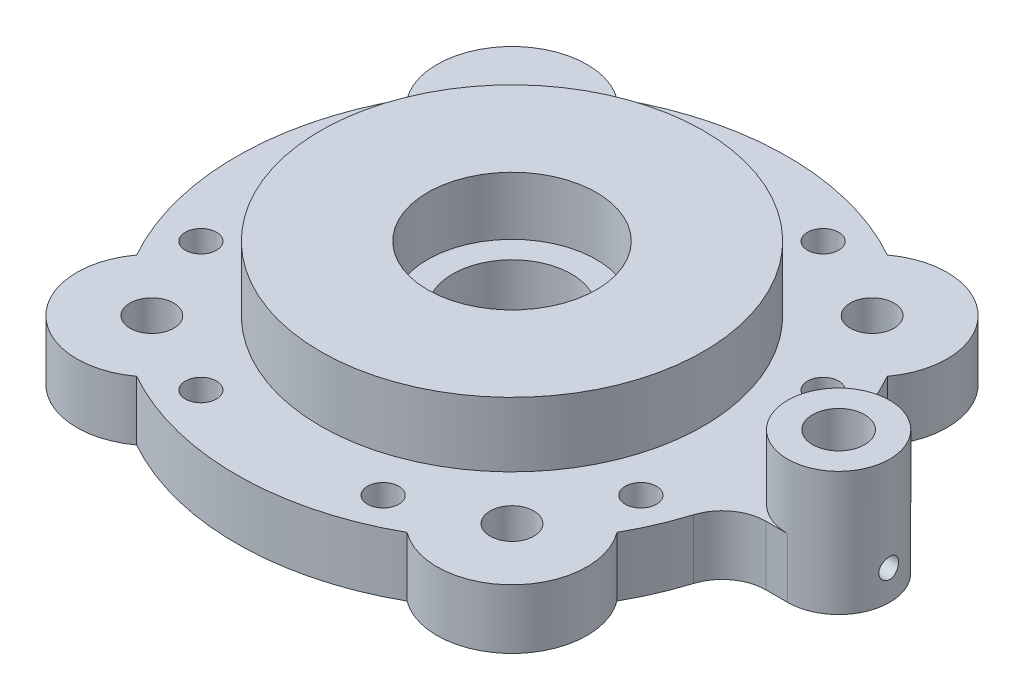
from build123d import *

# Parameters (mm, degrees)
BASE_DEPTH                       = 9.525
SQUARE_BOLT_HOLES_DEPTH          = 76.417831
SQUARE_BOLT_HOLES_DEPTH_BACK     = 76.417831
SKETCH3_R                        = 3.5
SKETCH11_R                       = 12
SKETCH11_R_2                     = 3.5
BOSS_EXTRUDE1_DEPTH              = 9.525
SKETCH4_R                        = 2.5
HOUSING_BOLTS_DEPTH              = 44.33
CIRPATTERN1_COUNT                = 8
SKETCH2_R                        = 30.626685
SKETCH2_R_2                      = 8.167187
SKETCH2_R_3                      = 4.167187
IMPELLER_CAVITY_RISER_DEPTH      = 10.32955
SKETCH5_R                        = 13.5
SEAL_BORE_DEPTH                  = 9.3
SKETCH6_R                        = 9.5
BORE_DEPTH                       = 39.3
PRESSURE_TAP_DEPTH               = 101.589528
PRESSURE_TAP_DEPTH_BACK          = 52.75
SKETCH9_R                        = 1.5875
SKETCH10_R                       = 1.5875
PRESSURE_TAP_VERTICAL_HOLE_DEPTH = 6.35


with BuildPart() as part:
    # Sketch1 → base (new body)
    with BuildSketch(Plane(origin=(0, 0, 0), x_dir=(1, 0, 0), z_dir=(0, 1, 0))):
        with BuildLine():
            Line((48.797197, 8.167187), (52.267188, 8.167188))
            ThreePointArc((52.267188, 8.167188), (60.434375, 0), (52.267188, -8.167188))
            Line((52.267188, -8.167188), (48.797197, -8.167188))
            ThreePointArc((48.797197, -8.167188), (44.646527, -9.530527), (42.112649, -13.089491))
            ThreePointArc((42.112649, -13.089491), (-44.1, 0), (42.112649, 13.089491))
            ThreePointArc((42.112649, 13.089491), (44.646527, 9.530527), (48.797197, 8.167187))
        make_face()
    extrude(amount=BASE_DEPTH)

    # Sketch3 → square bolt holes (cut, two sides: drawn at the far end of the back side and taken through both)
    with BuildSketch(Plane.XZ.offset(-SQUARE_BOLT_HOLES_DEPTH_BACK)):
        with Locations((-28.814601, -28.814601)):
            Circle(SKETCH3_R)
        with Locations((-28.814601, 28.814601)):
            Circle(SKETCH3_R)
        with Locations((28.814601, 28.814601)):
            Circle(SKETCH3_R)
        with Locations((28.814601, -28.814601)):
            Circle(SKETCH3_R)
    extrude(amount=SQUARE_BOLT_HOLES_DEPTH + SQUARE_BOLT_HOLES_DEPTH_BACK, mode=Mode.SUBTRACT)

    # Sketch11 → Boss-Extrude1 (add)
    # profile 1 of 4: a face of its own
    with BuildSketch(Plane.XZ):
        with Locations((-28.814601, 28.814601)):
            Circle(SKETCH11_R)
        with Locations(Location((-28.814601, 28.814601, 0), (0, 0, 270))):
            Circle(SKETCH11_R_2, mode=Mode.SUBTRACT)
    # profile 2 of 4: a face of its own
    with BuildSketch(Plane.XZ):
        with Locations((28.814601, 28.814601)):
            Circle(SKETCH11_R)
        with Locations(Location((28.814601, 28.814601, 0), (0, 0, 270))):
            Circle(SKETCH11_R_2, mode=Mode.SUBTRACT)
    # profile 3 of 4: a face of its own
    with BuildSketch(Plane.XZ):
        with Locations((28.814601, -28.814601)):
            Circle(SKETCH11_R)
        with Locations(Location((28.814601, -28.814601, 0), (0, 0, 270))):
            Circle(SKETCH11_R_2, mode=Mode.SUBTRACT)
    # profile 4 of 4: a face of its own
    with BuildSketch(Plane.XZ):
        with Locations((-28.814601, -28.814601)):
            Circle(SKETCH11_R)
        with Locations(Location((-28.814601, -28.814601, 0), (0, 0, 270))):
            Circle(SKETCH11_R_2, mode=Mode.SUBTRACT)
    extrude(amount=-BOSS_EXTRUDE1_DEPTH)

    # Sketch4 → housing bolts (cut)
    with BuildSketch(Plane(origin=(0, 9.525, 0), x_dir=(1, 0, 0), z_dir=(0, 1, 0))):
        with Locations(Location((14.580239, 35.19981, 0), (0, 0, 270))):
            Circle(SKETCH4_R)
    housing_bolts = extrude(amount=-HOUSING_BOLTS_DEPTH, mode=Mode.SUBTRACT)

    # CirPattern1: housing bolts ×8 about axis
    cirpattern1_axis = Axis((0, 0, 0), (0, 1, 0))
    for i in range(1, CIRPATTERN1_COUNT):
        add(housing_bolts.rotate(cirpattern1_axis, i * 360 / CIRPATTERN1_COUNT), mode=Mode.SUBTRACT)

    # Sketch2 → impeller cavity riser (add)
    # profile 1 of 2: a face of its own
    with BuildSketch(Plane(origin=(0, 9.525, 0), x_dir=(1, 0, 0), z_dir=(0, 1, 0))):
        with Locations(Location((0, 0, 0), (0, 0, 270))):
            Circle(SKETCH2_R)
    # profile 2 of 2: a face of its own
    with BuildSketch(Plane(origin=(0, 9.525, 0), x_dir=(1, 0, 0), z_dir=(0, 1, 0))):
        with Locations(Location((52.267188, 0, 0), (0, 0, 270))):
            Circle(SKETCH2_R_2)
        with Locations(Location((52.267188, 0, 0), (0, 0, 270))):
            Circle(SKETCH2_R_3, mode=Mode.SUBTRACT)
    extrude(amount=IMPELLER_CAVITY_RISER_DEPTH)

    # Sketch5 → seal bore (cut)
    with BuildSketch(Plane(origin=(0, 19.85455, 0), x_dir=(1, 0, 0), z_dir=(0, 1, 0))):
        with Locations(Location((0, 0, 0), (0, 0, 270))):
            Circle(SKETCH5_R)
    extrude(amount=-SEAL_BORE_DEPTH, mode=Mode.SUBTRACT)

    # Sketch6 → bore (cut)
    with BuildSketch(Plane(origin=(0, 10.55455, 0), x_dir=(1, 0, 0), z_dir=(0, 1, 0))):
        with Locations(Location((0, 0, 0), (0, 0, 270))):
            Circle(SKETCH6_R)
    extrude(amount=-BORE_DEPTH, mode=Mode.SUBTRACT)

    # Sketch9 → pressure tap (cut, two sides: drawn at the far end of the back side and taken through both)
    with BuildSketch(Plane(origin=(44.1, 0, 0), x_dir=(0, 0, -1), z_dir=(1, 0, 0)).offset(-PRESSURE_TAP_DEPTH_BACK)):
        with Locations(Location((0, 4.7625, 0), (0, 0, 180))):
            Circle(SKETCH9_R)
    extrude(amount=PRESSURE_TAP_DEPTH + PRESSURE_TAP_DEPTH_BACK, mode=Mode.SUBTRACT)

    # Sketch10 → pressure tap vertical hole (cut)
    with BuildSketch(Plane(origin=(0, 9.525, 0), x_dir=(1, 0, 0), z_dir=(0, 1, 0))):
        with Locations(Location((52.267188, 0, 0), (0, 0, 270))):
            Circle(SKETCH10_R)
    extrude(amount=-PRESSURE_TAP_VERTICAL_HOLE_DEPTH, mode=Mode.SUBTRACT)


solid = part.part
